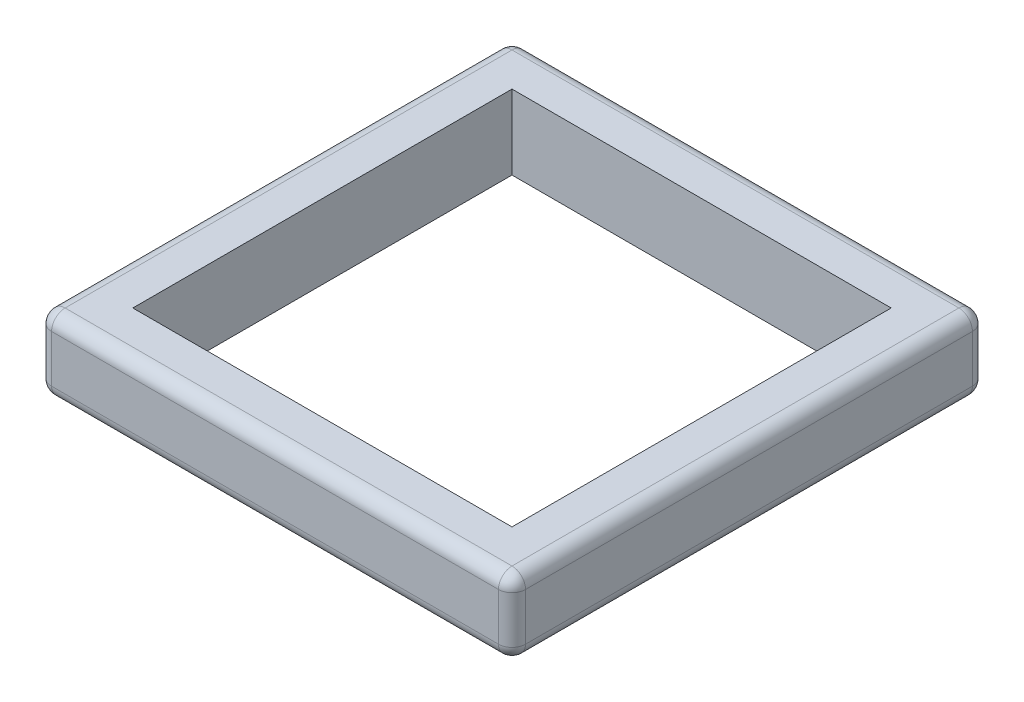
from build123d import *

# Parameters (mm, degrees)
SKETCH1_W           = 889
SKETCH1_H           = 889
SKETCH1_W_2         = 711.2
SKETCH1_H_2         = 711.2
BOSS_EXTRUDE1_DEPTH = 139.7
FILLET2_R           = 25.4


with BuildPart() as part:
    # Sketch1 → Boss-Extrude1 (new body)
    with BuildSketch(Plane(origin=(0, 0, 0), x_dir=(1, 0, 0), z_dir=(0, 1, 0))):
        with Locations((-38.710886076, -21.155949367)):
            Rectangle(SKETCH1_W, SKETCH1_H)
        with Locations((-38.710886076, -21.155949367)):
            Rectangle(SKETCH1_W_2, SKETCH1_H_2, mode=Mode.SUBTRACT)
    extrude(amount=BOSS_EXTRUDE1_DEPTH)

    # Fillet2
    fillet2_edges = [part.edges().sort_by_distance(p)[0] for p in [
        (-483.210886076, 139.7, 21.155949367),
        (-38.710886076, 139.7, 465.655949367),
        (405.789113924, 139.7, 21.155949367),
        (-38.710886076, 0, 465.655949367),
        (-483.210886076, 0, 21.155949367),
        (-38.710886076, 0, -423.344050633),
        (405.789113924, 0, 21.155949367),
        (405.789113924, 69.85, 465.655949367),
        (-483.210886076, 69.85, 465.655949367),
        (-483.210886076, 69.85, -423.344050633),
        (405.789113924, 69.85, -423.344050633),
        (-38.710886076, 139.7, -423.344050633),
    ]]
    fillet(fillet2_edges, radius=FILLET2_R)


solid = part.part
